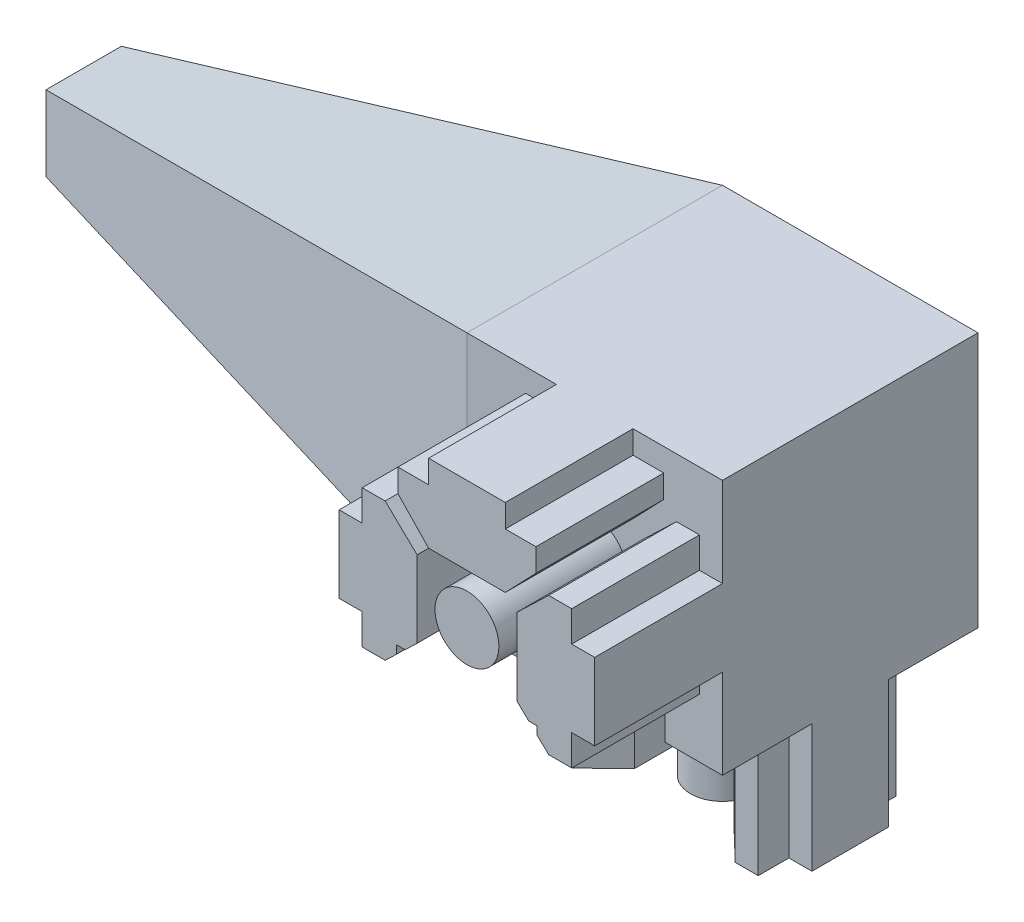
from build123d import *

# Parameters (mm, degrees)
SKETCH1_W           = 20
SKETCH1_H           = 20
BOSS_EXTRUDE1_DEPTH = 20
SKETCH1_4_R         = 2.5
BOSS_EXTRUDE3_DEPTH = 10
SKETCH5_W           = 2.4
SKETCH5_H           = 1.8
CUT_EXTRUDE1_DEPTH  = 6.2
SKETCH8_R           = 2.5
BOSS_EXTRUDE4_DEPTH = 10
SKETCH10_W          = 20
SKETCH10_H          = 20
BOSS_EXTRUDE5_DEPTH = 40
BOSS_EXTRUDE5_TAPER = 10


with BuildPart() as part:
    # Sketch1 → Boss-Extrude1 (new body)
    with BuildSketch(Plane(origin=(0, 0, 0), x_dir=(1, 0, 0), z_dir=(0, 1, 0))):
        with Locations((10, -10)):
            Rectangle(SKETCH1_W, SKETCH1_H)
    extrude(amount=BOSS_EXTRUDE1_DEPTH)

    # Sketch1<4> → Boss-Extrude3 (add)
    with BuildSketch(Plane(origin=(0, 0, 0), x_dir=(1, 0, 0), z_dir=(0, 1, 0))):
        Polygon((13, 0), (7, 0), (7, -1.8), (4.6, -1.8), (4.6, -3.6), (7, -6.1), (13, -6.1), (15.4, -3.6), (15.4, -1.8), (13, -1.8), align=None)
        Polygon((0, -7), (0, -13), (1.8, -13), (1.8, -15.4), (3.6, -15.4), (6.1, -13), (6.1, -7), (3.6, -4.6), (1.8, -4.6), (1.8, -7), align=None)
        Polygon((20, -7), (18.2, -7), (18.2, -4.6), (16.4, -4.6), (13.9, -7), (13.9, -13), (16.4, -15.4), (18.2, -15.4), (18.2, -13), (20, -13), align=None)
        with Locations(Location((10, -10, 0), (0, 0, 270))):
            Circle(SKETCH1_4_R)
    extrude(amount=-BOSS_EXTRUDE3_DEPTH)

    # Sketch5 → Cut-Extrude1 (cut)
    with BuildSketch(Plane.XY.offset(20)):
        with Locations((14.3, 0.9)):
            Rectangle(SKETCH5_W, SKETCH5_H)
        with Locations((5.7, 0.9)):
            Rectangle(SKETCH5_W, SKETCH5_H)
        Polygon((6.9, 6.1), (4.5, 3.6), (4.5, 1.8), (6.9, 1.8), (6.9, 0), (13.1, 0), (13.1, 1.8), (15.5, 1.8), (15.5, 3.6), (13.1, 6.1), align=None)
        Polygon((4.5, 5.364), (4.5, 3.6), (6.9, 6.1), (5.266666667, 6.1), align=None)
        Polygon((14.733333333, 6.1), (13.1, 6.1), (15.5, 3.6), (15.5, 5.364), align=None)
        Polygon((15.5, 6.1), (14.733333333, 6.1), (15.5, 5.364), align=None)
        Polygon((4.5, 6.1), (4.5, 5.364), (5.266666667, 6.1), align=None)
    extrude(amount=-CUT_EXTRUDE1_DEPTH, mode=Mode.SUBTRACT)

    # Sketch8 → Boss-Extrude4 (add)
    with BuildSketch(Plane.XY.offset(20)):
        Polygon((13, 20), (7, 20), (7, 18.2), (4.6, 18.2), (4.6, 16.4), (7, 13.9), (13, 13.9), (15.4, 16.4), (15.4, 18.2), (13, 18.2), align=None)
        Polygon((0, 13), (0, 7), (1.8, 7), (1.8, 4.6), (3.6, 4.6), (4.5, 5.464), (4.5, 6.1), (5.1625, 6.1), (6.1, 7), (6.1, 13), (3.6, 15.4), (1.8, 15.4), (1.8, 13), align=None)
        Polygon((20, 13), (18.2, 13), (18.2, 15.4), (16.4, 15.4), (13.9, 13), (13.9, 7), (14.8375, 6.1), (15.5, 6.1), (15.5, 5.464), (16.4, 4.6), (18.2, 4.6), (18.2, 7), (20, 7), align=None)
        with Locations(Location((10, 10, 0), (0, 0, 180))):
            Circle(SKETCH8_R)
    extrude(amount=BOSS_EXTRUDE4_DEPTH)

    # Sketch10 → Boss-Extrude5 (add)
    with BuildSketch(Plane.ZY):
        with Locations((10, 10)):
            Rectangle(SKETCH10_W, SKETCH10_H)
    extrude(amount=BOSS_EXTRUDE5_DEPTH, taper=BOSS_EXTRUDE5_TAPER)


solid = part.part
